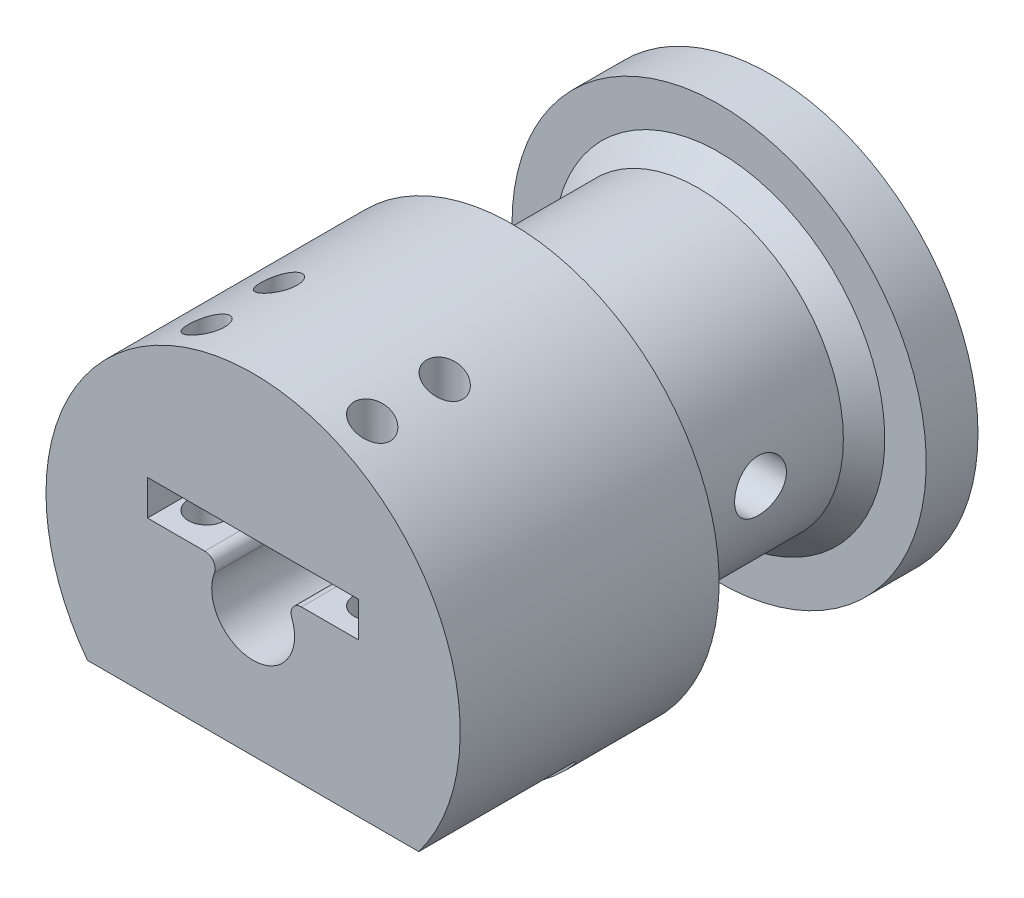
from build123d import *

# Parameters (mm, degrees)
SZKIC1_R                        = 20
SZKIC1_R_2                      = 4
DODANIE_WYCI_GNI_CIE1_DEPTH     = 50
WYTNIJ_WYCI_GNI_CIE1_START      = -14.5
WYTNIJ_WYCI_GNI_CIE1_DEPTH      = 14.5
WYTNIJ_WYCI_GNI_CIE2_DEPTH      = 59.479398082
WYTNIJ_WYCI_GNI_CIE2_DEPTH_BACK = 59.479398082
SZKIC3_R                        = 1.75
SZKIC4_W                        = 16
SZKIC4_H                        = 8
WYTNIJ_WYCI_GNI_CIE3_DEPTH      = 68.082039489
SZKIC6_W                        = 20
SZKIC6_H                        = 6
SFAZOWANIE1_SIZE                = 2
WYTNIJ_WYCI_GNI_CIE4_DEPTH      = 58.445626622
WYTNIJ_WYCI_GNI_CIE4_DEPTH_BACK = 58.445626622
SZKIC7_R                        = 2.5
SFAZOWANIE2_SIZE                = 1


with BuildPart() as part:
    # Szkic1 → Dodanie-wyciągnięcie1 (new body)
    with BuildSketch(Plane.XY):
        Circle(SZKIC1_R)
        Circle(SZKIC1_R_2, mode=Mode.SUBTRACT)
    extrude(amount=DODANIE_WYCI_GNI_CIE1_DEPTH)

    # Szkic2 → Wytnij-wyciągnięcie1 (cut)
    with BuildSketch(Plane.XY.offset(50).offset(WYTNIJ_WYCI_GNI_CIE1_START)):
        with BuildLine():
            Line((4.664761516, 2.8), (10.2, 2.8))
            Line((10.2, 2.8), (10.2, 6.2))
            Line((10.2, 6.2), (-10.2, 6.2))
            Line((-10.2, 6.2), (-10.2, 2.8))
            Line((-10.2, 2.8), (-4.664761516, 2.8))
            ThreePointArc((-4.664761516, 2.8), (-3.840140391, 2.365685425), (-3.731809213, 1.44))
            ThreePointArc((-3.731809213, 1.44), (0, -4), (3.731809213, 1.44))
            ThreePointArc((3.731809213, 1.44), (3.840140391, 2.365685425), (4.664761516, 2.8))
        make_face()
    extrude(amount=WYTNIJ_WYCI_GNI_CIE1_DEPTH, mode=Mode.SUBTRACT)

    # Szkic3 → Wytnij-wyciągnięcie2 (cut, two sides: drawn at the far end of the back side and taken through both)
    with BuildSketch(Plane(origin=(0, 2.8, 0), x_dir=(1, 0, 0), z_dir=(0, 1, 0)).offset(-WYTNIJ_WYCI_GNI_CIE2_DEPTH_BACK)):
        with Locations(Location((-8, -46.5, 0), (0, 0, 180))):
            Circle(SZKIC3_R)
        with Locations(Location((-8, -39.5, 0), (0, 0, 180))):
            Circle(SZKIC3_R)
        with Locations(Location((8, -46.5, 0), (0, 0, 180))):
            Circle(SZKIC3_R)
        with Locations(Location((8, -39.5, 0), (0, 0, 180))):
            Circle(SZKIC3_R)
    extrude(amount=WYTNIJ_WYCI_GNI_CIE2_DEPTH + WYTNIJ_WYCI_GNI_CIE2_DEPTH_BACK, mode=Mode.SUBTRACT)

    # Szkic4 → Wytnij-wyciągnięcie3 (cut, through all)
    with BuildSketch(Plane(origin=(20, 0, 0), x_dir=(0, 0, -1), z_dir=(1, 0, 0))):
        with Locations((-42, -16)):
            Rectangle(SZKIC4_W, SZKIC4_H)
    extrude(amount=-WYTNIJ_WYCI_GNI_CIE3_DEPTH, mode=Mode.SUBTRACT)

    # Szkic6 → Wycięcie-obrót1 (revolve, cut)
    with BuildSketch(Plane(origin=(0, 0, 0), x_dir=(0, 0, -1), z_dir=(1, 0, 0)), mode=Mode.PRIVATE) as wyci_cie_obr_t1_sk:
        with Locations((-15, 17)):
            Rectangle(SZKIC6_W, SZKIC6_H)
    revolve(wyci_cie_obr_t1_sk.sketch.rotate(Axis((0, 0, 0), (0, 0, 1)), 90), axis=Axis((0, 0, 0), (0, 0, 1)), mode=Mode.SUBTRACT)

    # Sfazowanie1
    sfazowanie1_edges = [part.edges().sort_by_distance(p)[0] for p in [
        (14, 0, 25),
        (14, 0, 5),
    ]]
    chamfer(sfazowanie1_edges, length=SFAZOWANIE1_SIZE)

    # Szkic7 → Wytnij-wyciągnięcie4 (cut, two sides: drawn at the far end of the back side and taken through both)
    with BuildSketch(Plane(origin=(0, 0, 0), x_dir=(0, 0, -1), z_dir=(1, 0, 0)).offset(-WYTNIJ_WYCI_GNI_CIE4_DEPTH_BACK)):
        with Locations((-15, 0)):
            Circle(SZKIC7_R)
    extrude(amount=WYTNIJ_WYCI_GNI_CIE4_DEPTH + WYTNIJ_WYCI_GNI_CIE4_DEPTH_BACK, mode=Mode.SUBTRACT)

    # Sfazowanie2
    sfazowanie2_edges = [part.edges().sort_by_distance(p)[0] for p in [
        (0, -12, 34),
    ]]
    chamfer(sfazowanie2_edges, length=SFAZOWANIE2_SIZE)


solid = part.part
